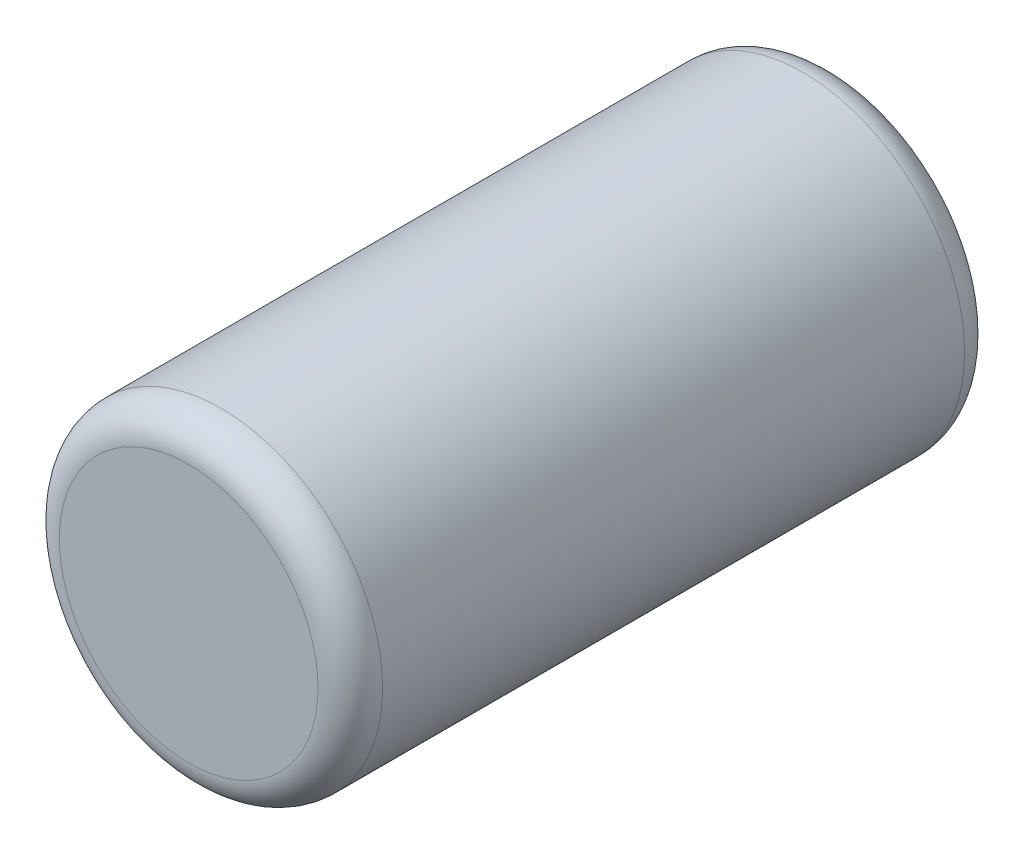
from build123d import *

# Parameters (mm, degrees)
SKETCH1_R           = 2.5
BOSS_EXTRUDE1_DEPTH = 10
FILLET1_R           = 0.5


with BuildPart() as part:
    # Sketch1 → Boss-Extrude1 (new body)
    with BuildSketch(Plane.XY):
        Circle(SKETCH1_R)
    extrude(amount=BOSS_EXTRUDE1_DEPTH)

    # Fillet1
    fillet1_edges = [part.edges().sort_by_distance(p)[0] for p in [
        (-2.5, 0, 0),
        (-2.5, 0, 10),
    ]]
    fillet(fillet1_edges, radius=FILLET1_R)


solid = part.part
